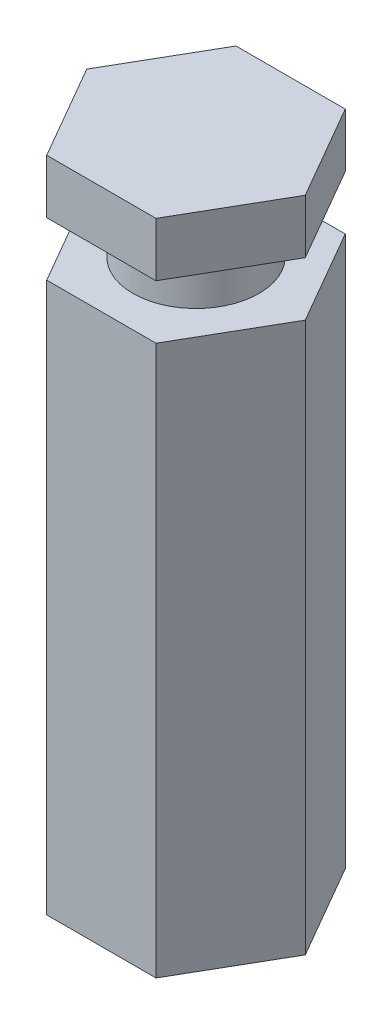
from build123d import *

# Parameters (mm, degrees)
BOSS_EXTRUDE1_DEPTH = 61
SKETCH2_R           = 7
BOSS_EXTRUDE2_DEPTH = 6
BOSS_EXTRUDE3_DEPTH = 6


with BuildPart() as part:
    # Sketch1 → Boss-Extrude1 (new body)
    with BuildSketch(Plane(origin=(0, 0, 0), x_dir=(1, 0, 0), z_dir=(0, 1, 0))):
        Polygon((-12.124355653, 0), (-6.062177826, -10.5), (6.062177826, -10.5), (12.124355653, 0), (6.062177826, 10.5), (-6.062177826, 10.5), align=None)
    extrude(amount=BOSS_EXTRUDE1_DEPTH)

    # Sketch2 → Boss-Extrude2 (add)
    with BuildSketch(Plane(origin=(0, 61, 0), x_dir=(1, 0, 0), z_dir=(0, 1, 0))):
        with Locations(Location((0, 0, 0), (0, 0, 270))):
            Circle(SKETCH2_R)
    extrude(amount=BOSS_EXTRUDE2_DEPTH)

    # Sketch3 → Boss-Extrude3 (add)
    with BuildSketch(Plane(origin=(0, 67, 0), x_dir=(1, 0, 0), z_dir=(0, 1, 0))):
        Polygon((-12.124355653, 0), (-6.062177826, -10.5), (6.062177826, -10.5), (12.124355653, 0), (6.062177826, 10.5), (-6.062177826, 10.5), align=None)
    extrude(amount=BOSS_EXTRUDE3_DEPTH)


solid = part.part
